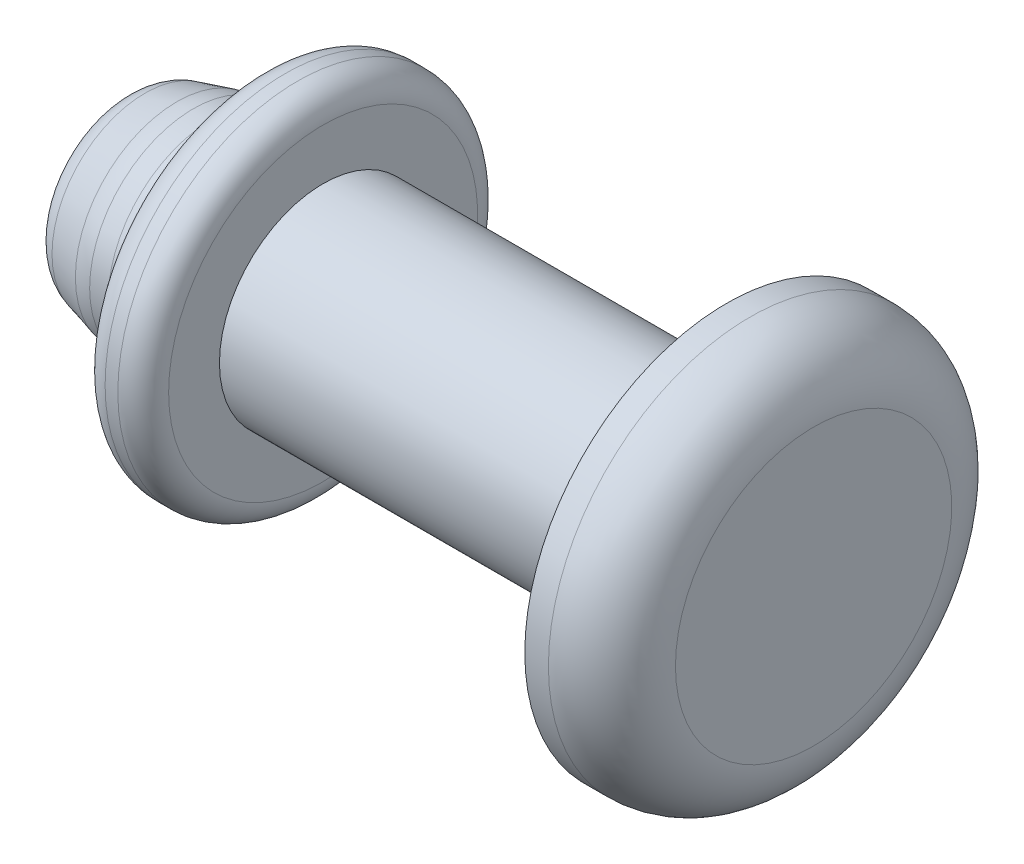
from build123d import *


with BuildPart() as part:
    # Sketch2 → Revolve1 (revolve)
    with BuildSketch(Plane.XY, mode=Mode.PRIVATE) as revolve1_sk:
        with BuildLine():
            Line((0, 0), (0, 2.175))
            ThreePointArc((0, 2.175), (-0.292893219, 2.882106781), (-1, 3.175))
            Line((-1, 3.175), (-1.3716, 3.175))
            Line((-1.3716, 3.175), (-1.3716, 1.63195))
            Line((-1.3716, 1.63195), (-7.7216, 1.63195))
            Line((-7.7216, 1.63195), (-7.7216, 2.43195))
            ThreePointArc((-7.7216, 2.43195), (-7.838757288, 2.714792712), (-8.1216, 2.83195))
            Line((-8.1216, 2.83195), (-8.3216, 2.83195))
            ThreePointArc((-8.3216, 2.83195), (-8.604442712, 2.714792712), (-8.7216, 2.43195))
            Line((-8.7216, 2.43195), (-8.7216, 2.38195))
            ThreePointArc((-8.7216, 2.38195), (-8.941269914, 1.851619914), (-9.4716, 1.63195))
            Line((-9.4716, 1.63195), (-9.764947502, 1.63195))
            ThreePointArc((-9.764947502, 1.63195), (-9.895473695, 1.623394861), (-10.023766548, 1.597875826))
            Line((-10.023766548, 1.597875826), (-10.526009523, 1.463300227))
            ThreePointArc((-10.526009523, 1.463300227), (-10.79327667, 1.284718028), (-10.8966, 0.980337314))
            Line((-10.8966, 0.980337314), (-10.8966, 0))
            Line((-10.8966, 0), (0, 0))
        make_face()
    revolve(revolve1_sk.sketch.rotate(Axis((-42.300017882, 0, 0), (1, 0, 0)), 90), axis=Axis((-42.300017882, 0, 0), (1, 0, 0)))


solid = part.part
